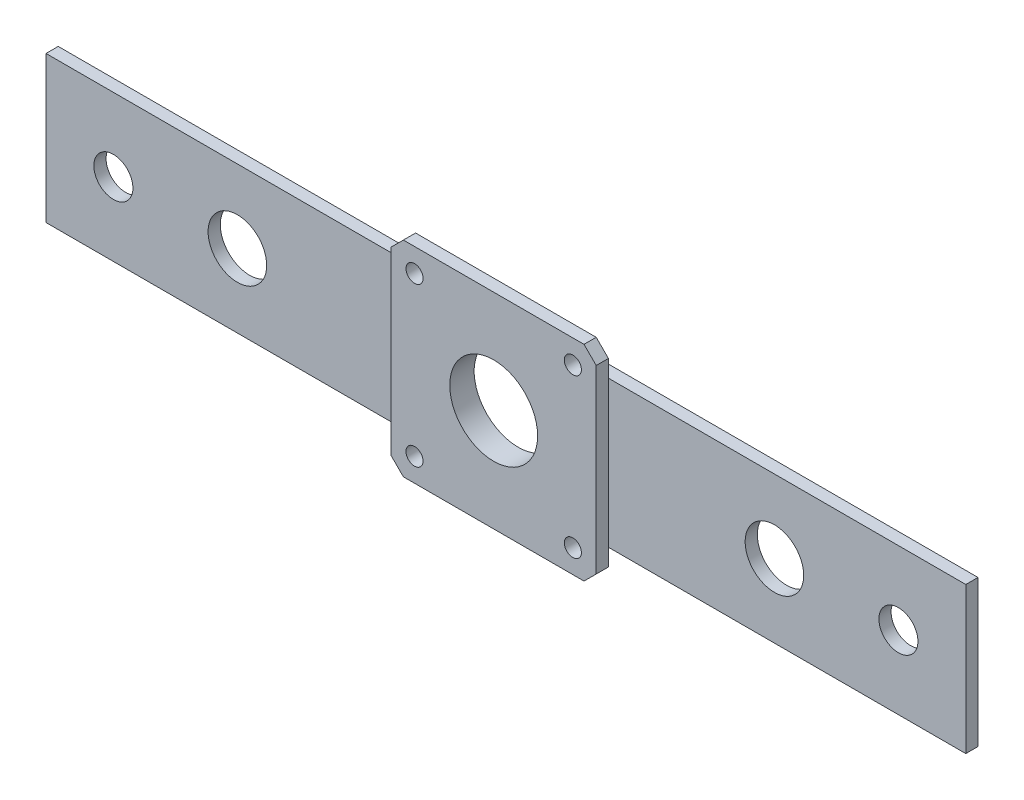
from build123d import *

# Parameters (mm, degrees)
SKETCH1_W               = 188.4
SKETCH1_H               = 30
BOSS_EXTRUDE1_DEPTH     = 2.5
SKETCH2_R               = 6
SKETCH2_R_2             = 4
CUT_EXTRUDE2_DEPTH      = 96.419547264
SKETCH3_R               = 1.75
BOSS_EXTRUDE4_DEPTH     = 2.5
CUT_EXTRUDE5_DEPTH      = 14.5
CUT_EXTRUDE5_DEPTH_BACK = 14.5
SKETCH5_R               = 9


with BuildPart() as part:
    # Sketch1 → Boss-Extrude1 (new body)
    with BuildSketch(Plane.XY):
        Rectangle(SKETCH1_W, SKETCH1_H)
    extrude(amount=BOSS_EXTRUDE1_DEPTH)

    # Sketch2 → Cut-Extrude2 (cut, through all)
    with BuildSketch(Plane.XY.offset(2.5)):
        with Locations((-55, 0)):
            Circle(SKETCH2_R)
        with Locations(Location((55, 0, 0), (0, 0, 180))):
            Circle(SKETCH2_R)
        Circle(SKETCH2_R)
        with Locations((-80.4, 0)):
            Circle(SKETCH2_R_2)
        with Locations(Location((80.4, 0, 0), (0, 0, 180))):
            Circle(SKETCH2_R_2)
    extrude(amount=-CUT_EXTRUDE2_DEPTH, mode=Mode.SUBTRACT)

    # Sketch3 → Boss-Extrude4 (add)
    with BuildSketch(Plane.XY.offset(2.5)):
        Polygon((-21, 18.5), (-18.5, 21), (18.5, 21), (21, 18.5), (21, -18.5), (18.5, -21), (-18.5, -21), (-21, -18.5), align=None)
        with Locations(Location((16.214466094, 16.214466094, 0), (0, 0, 223.946041773))):
            Circle(SKETCH3_R, mode=Mode.SUBTRACT)
        with Locations(Location((-16.214466094, -16.214466094, 0), (0, 0, 180))):
            Circle(SKETCH3_R, mode=Mode.SUBTRACT)
        with Locations(Location((16.214466094, -16.214466094, 0), (0, 0, 136.053958227))):
            Circle(SKETCH3_R, mode=Mode.SUBTRACT)
        with Locations(Location((-16.214466094, 16.214466094, 0), (0, 0, 180))):
            Circle(SKETCH3_R, mode=Mode.SUBTRACT)
    extrude(amount=BOSS_EXTRUDE4_DEPTH)

    # Sketch5 → Cut-Extrude5 (cut, two sides: drawn at the far end of the back side and taken through both)
    with BuildSketch(Plane(origin=(0, 0, 2.5), x_dir=(-1, 0, 0), z_dir=(0, 0, -1)).offset(-CUT_EXTRUDE5_DEPTH_BACK)):
        with Locations(Location((0, 0, 0), (0, 0, 180))):
            Circle(SKETCH5_R)
    extrude(amount=CUT_EXTRUDE5_DEPTH + CUT_EXTRUDE5_DEPTH_BACK, mode=Mode.SUBTRACT)


solid = part.part
